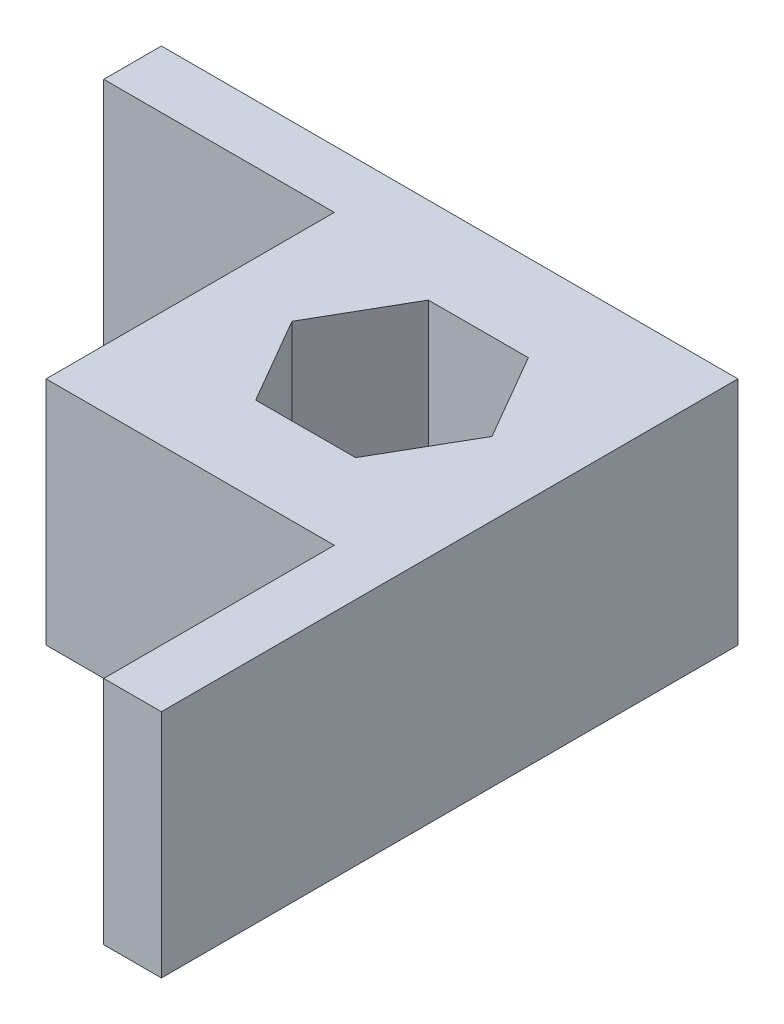
from build123d import *

# Parameters (mm, degrees)
BOSS_EXTRUDE1_DEPTH = 20
CUT_EXTRUDE1_DEPTH  = 20


with BuildPart() as part:
    # Sketch2 → Boss-Extrude1 (new body)
    with BuildSketch(Plane(origin=(0, 0, 0), x_dir=(1, 0, 0), z_dir=(0, 1, 0))):
        Polygon((0, 0), (50, 0), (50, -50), (45, -50), (45, -30), (20, -30), (20, -5), (0, -5), align=None)
    extrude(amount=BOSS_EXTRUDE1_DEPTH)

    # Sketch3 → Cut-Extrude1 (cut)
    with BuildSketch(Plane(origin=(0, 20, 0), x_dir=(1, 0, 0), z_dir=(0, 1, 0))):
        Polygon((39.341240981, -22.493572362), (43.660244521, -14.987161207), (39.31900354, -7.493588845), (30.658759019, -7.506427638), (26.339755479, -15.012838793), (30.68099646, -22.506411155), align=None)
    extrude(amount=-CUT_EXTRUDE1_DEPTH, mode=Mode.SUBTRACT)


solid = part.part
